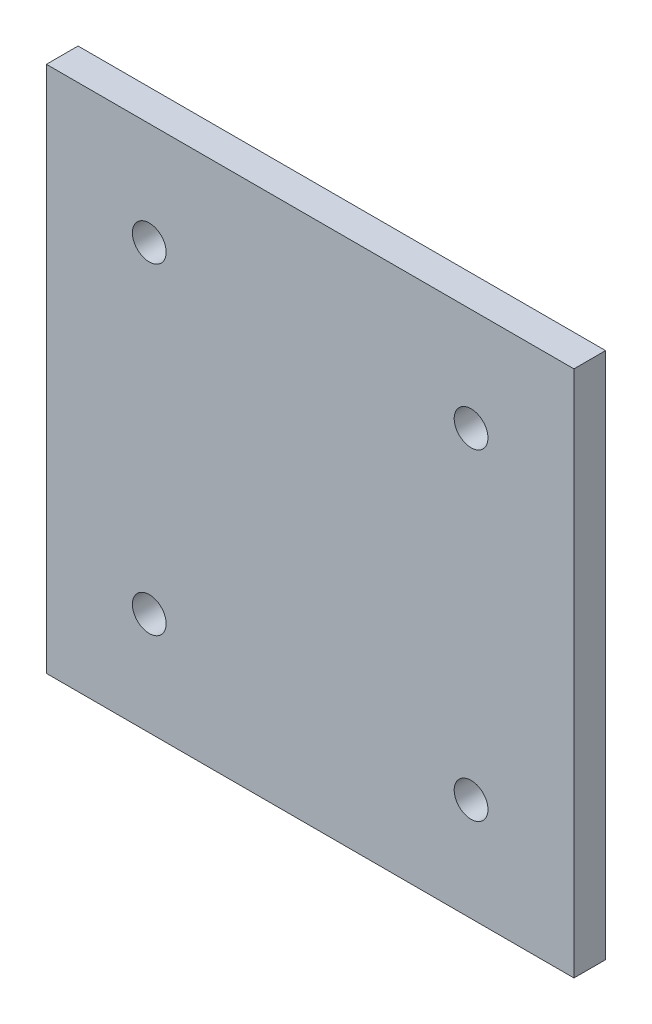
from build123d import *

# Parameters (mm, degrees)
SKETCH_1_W        = 50
SKETCH_1_H        = 50
SKETCH_1_R        = 1.6
EXTRUDE_219_DEPTH = 3


with BuildPart() as part:
    # 草图1 → Extrude 219 (new body)
    with BuildSketch(Plane.XY):
        Rectangle(SKETCH_1_W, SKETCH_1_H)
        with Locations((-15.25, -15.25)):
            Circle(SKETCH_1_R, mode=Mode.SUBTRACT)
        with Locations((-15.25, 15.25)):
            Circle(SKETCH_1_R, mode=Mode.SUBTRACT)
        with Locations((15.25, -15.25)):
            Circle(SKETCH_1_R, mode=Mode.SUBTRACT)
        with Locations((15.25, 15.25)):
            Circle(SKETCH_1_R, mode=Mode.SUBTRACT)
    extrude(amount=EXTRUDE_219_DEPTH)


solid = part.part
